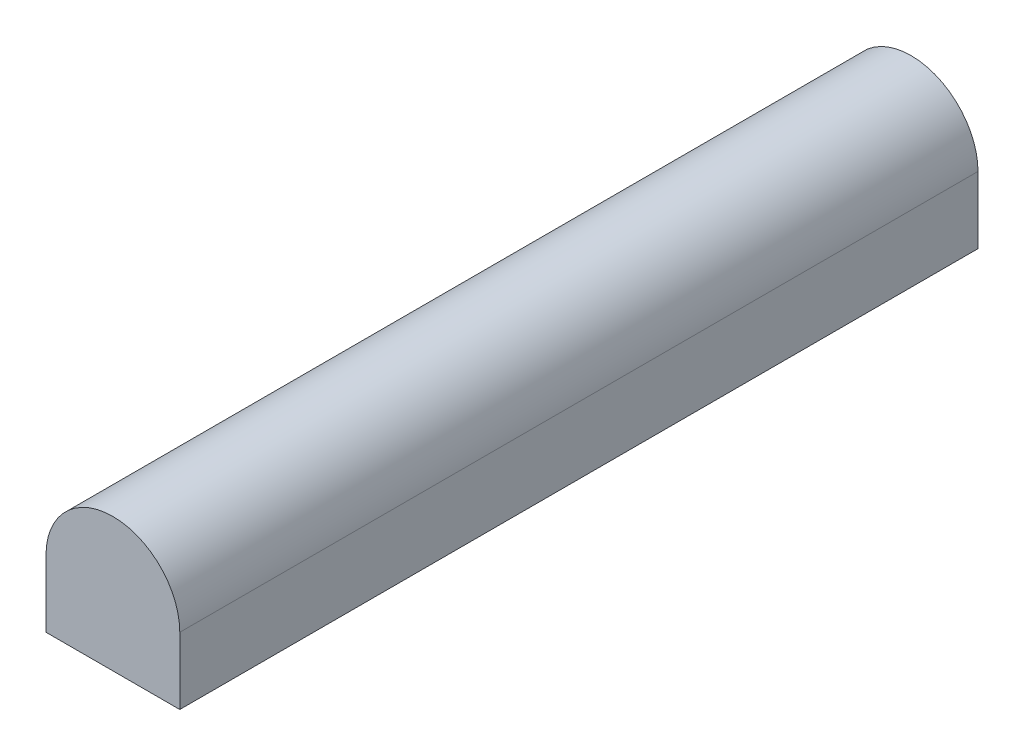
from build123d import *

# Parameters (mm, degrees)
SALIENTE_EXTRUIR1_DEPTH = 89.5
CROQUIS3_R              = 6
CORTAR_EXTRUIR1_DEPTH   = 15


with BuildPart() as part:
    # Croquis2 → Saliente-Extruir1 (new, symmetric)
    with BuildSketch(Plane.XY):
        with BuildLine():
            Line((-14.226804124, -9.536082474), (15.773195876, -9.536082474))
            Line((15.773195876, -9.536082474), (15.773195876, 5.463917526))
            ThreePointArc((15.773195876, 5.463917526), (0.773195876, 20.463917526), (-14.226804124, 5.463917526))
            Line((-14.226804124, 5.463917526), (-14.226804124, -9.536082474))
        make_face()
    extrude(amount=SALIENTE_EXTRUIR1_DEPTH, both=True)

    # Croquis3 → Cortar-Extruir1 (cut)
    with BuildSketch(Plane.XZ.offset(9.536082474)):
        with Locations(Location((0, 69.5, 0), (0, 0, 270))):
            Circle(CROQUIS3_R)
        with Locations(Location((0, -69.5, 0), (0, 0, 270))):
            Circle(CROQUIS3_R)
    extrude(amount=-CORTAR_EXTRUIR1_DEPTH, mode=Mode.SUBTRACT)


solid = part.part
